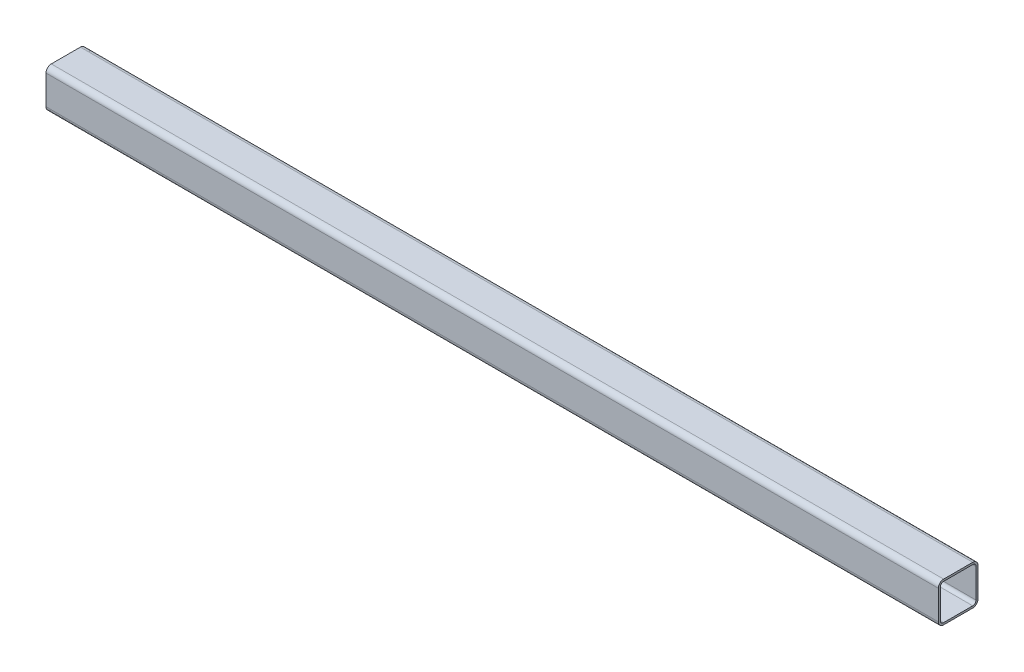
from build123d import *

# Parameters (mm, degrees)
EXTRUDE_THIN1_DEPTH      = 675
EXTRUDE_THIN1_DEPTH_BACK = 675


with BuildPart() as part:
    # Sketch1 → Extrude-Thin1 (new, two sides: drawn at the far end of the back side and taken through both)
    with BuildSketch(Plane(origin=(0, 0, 0), x_dir=(0, 0, -1), z_dir=(1, 0, 0)).offset(-EXTRUDE_THIN1_DEPTH_BACK)):
        with BuildLine():
            Line((-30, 22), (-30, -22))
            ThreePointArc((-30, -22), (-27.656854249, -27.656854249), (-22, -30))
            Line((-22, -30), (22, -30))
            ThreePointArc((22, -30), (27.656854249, -27.656854249), (30, -22))
            Line((30, -22), (30, 22))
            ThreePointArc((30, 22), (27.656854249, 27.656854249), (22, 30))
            Line((22, 30), (-22, 30))
            ThreePointArc((-22, 30), (-27.656854249, 27.656854249), (-30, 22))
        make_face()
        with BuildLine():
            Line((-27, 22), (-27, -22))
            ThreePointArc((-27, -22), (-25.535533906, -25.535533906), (-22, -27))
            Line((-22, -27), (22, -27))
            ThreePointArc((22, -27), (25.535533906, -25.535533906), (27, -22))
            Line((27, -22), (27, 22))
            ThreePointArc((27, 22), (25.535533906, 25.535533906), (22, 27))
            Line((22, 27), (-22, 27))
            ThreePointArc((-22, 27), (-25.535533906, 25.535533906), (-27, 22))
        make_face(mode=Mode.SUBTRACT)
    extrude(amount=EXTRUDE_THIN1_DEPTH + EXTRUDE_THIN1_DEPTH_BACK)


solid = part.part
